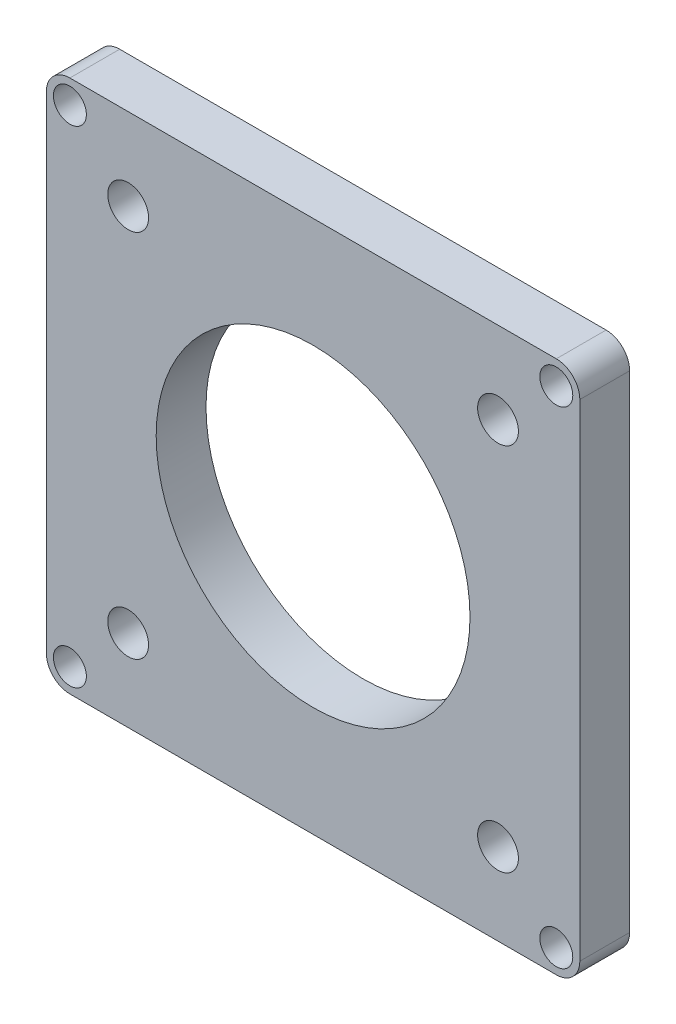
from build123d import *

# Parameters (mm, degrees)
SKETCH1_W           = 68
SKETCH1_H           = 68
SKETCH1_R           = 2.6
SKETCH1_R_2         = 2.1
SKETCH1_R_3         = 20
BOSS_EXTRUDE1_DEPTH = 3.175
FILLET2_R           = 3


with BuildPart() as part:
    # Sketch1 → Boss-Extrude1 (new, symmetric)
    with BuildSketch(Plane.XY):
        Rectangle(SKETCH1_W, SKETCH1_H)
        with Locations((-23.57, 23.57)):
            Circle(SKETCH1_R, mode=Mode.SUBTRACT)
        with Locations((23.57, 23.57)):
            Circle(SKETCH1_R, mode=Mode.SUBTRACT)
        with Locations((23.57, -23.57)):
            Circle(SKETCH1_R, mode=Mode.SUBTRACT)
        with Locations((-23.57, -23.57)):
            Circle(SKETCH1_R, mode=Mode.SUBTRACT)
        with Locations((-31, 31)):
            Circle(SKETCH1_R_2, mode=Mode.SUBTRACT)
        with Locations((31, 31)):
            Circle(SKETCH1_R_2, mode=Mode.SUBTRACT)
        with Locations((31, -31)):
            Circle(SKETCH1_R_2, mode=Mode.SUBTRACT)
        with Locations((-31, -31)):
            Circle(SKETCH1_R_2, mode=Mode.SUBTRACT)
        Circle(SKETCH1_R_3, mode=Mode.SUBTRACT)
    extrude(amount=BOSS_EXTRUDE1_DEPTH, both=True)

    # Fillet2
    fillet2_edges = [part.edges().sort_by_distance(p)[0] for p in [
        (-34, 34, 0),
        (34, 34, 0),
        (34, -34, 0),
        (-34, -34, 0),
    ]]
    fillet(fillet2_edges, radius=FILLET2_R)


solid = part.part
